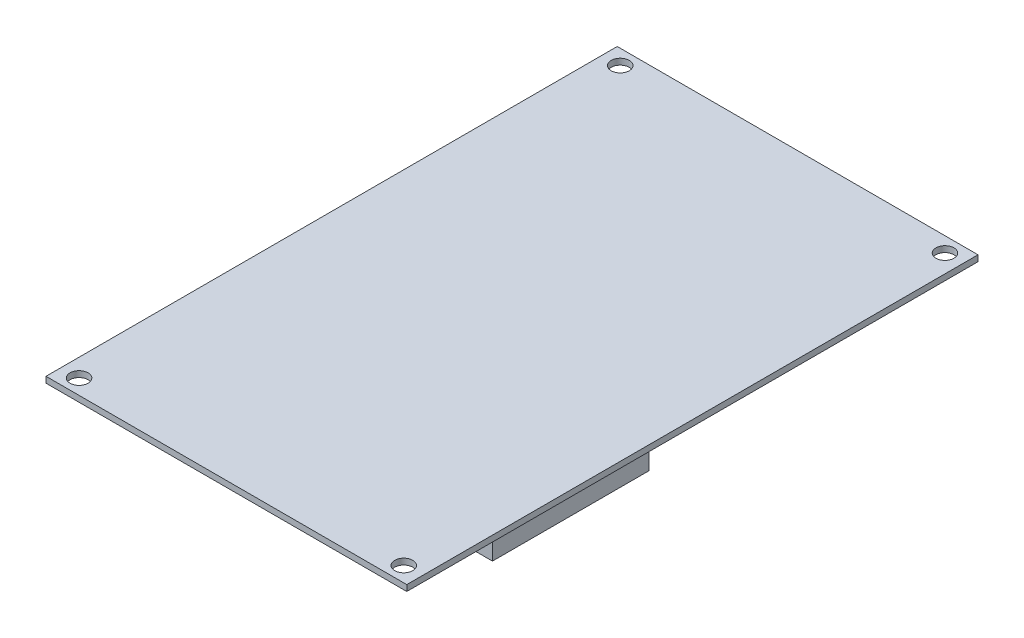
from build123d import *

# Parameters (mm, degrees)
SKETCH1_W           = 60
SKETCH1_H           = 95
BOSS_EXTRUDE1_DEPTH = 1
SKETCH2_W           = 5
SKETCH2_H           = 26
BOSS_EXTRUDE2_DEPTH = 8.5
CUT_EXTRUDE1_REACH  = 58.978
SKETCH3_R           = 1.5


with BuildPart() as part:
    # Sketch1 → Boss-Extrude1 (new body)
    with BuildSketch(Plane(origin=(0, 0, 0), x_dir=(1, 0, 0), z_dir=(0, 1, 0))):
        Rectangle(SKETCH1_W, SKETCH1_H)
    extrude(amount=BOSS_EXTRUDE1_DEPTH)

    # Sketch2 → Boss-Extrude2 (add)
    with BuildSketch(Plane.XZ):
        with Locations((21.75, 14.5)):
            Rectangle(SKETCH2_W, SKETCH2_H)
        with Locations((-21.75, 14.5)):
            Rectangle(SKETCH2_W, SKETCH2_H)
    extrude(amount=BOSS_EXTRUDE2_DEPTH)

    # Sketch3 → Cut-Extrude1 (cut, up to next)
    with BuildSketch(Plane(origin=(0, 1, 0), x_dir=(1, 0, 0), z_dir=(0, 1, 0)), mode=Mode.PRIVATE) as cut_extrude1_sk1:
        with Locations(Location((-27, -45, 0), (0, 0, 270))):
            Circle(SKETCH3_R)
    cut_extrude1_tool1 = extrude(cut_extrude1_sk1.sketch, amount=-CUT_EXTRUDE1_REACH, mode=Mode.PRIVATE) & part.part
    # Sketch3 → Cut-Extrude1 (cut, up to next)
    with BuildSketch(Plane(origin=(0, 1, 0), x_dir=(1, 0, 0), z_dir=(0, 1, 0)), mode=Mode.PRIVATE) as cut_extrude1_sk2:
        with Locations(Location((27, -45, 0), (0, 0, 270))):
            Circle(SKETCH3_R)
    cut_extrude1_tool2 = extrude(cut_extrude1_sk2.sketch, amount=-CUT_EXTRUDE1_REACH, mode=Mode.PRIVATE) & part.part
    # Sketch3 → Cut-Extrude1 (cut, up to next)
    with BuildSketch(Plane(origin=(0, 1, 0), x_dir=(1, 0, 0), z_dir=(0, 1, 0)), mode=Mode.PRIVATE) as cut_extrude1_sk3:
        with Locations(Location((27, 45, 0), (0, 0, 270))):
            Circle(SKETCH3_R)
    cut_extrude1_tool3 = extrude(cut_extrude1_sk3.sketch, amount=-CUT_EXTRUDE1_REACH, mode=Mode.PRIVATE) & part.part
    # Sketch3 → Cut-Extrude1 (cut, up to next)
    with BuildSketch(Plane(origin=(0, 1, 0), x_dir=(1, 0, 0), z_dir=(0, 1, 0)), mode=Mode.PRIVATE) as cut_extrude1_sk4:
        with Locations(Location((-27, 45, 0), (0, 0, 270))):
            Circle(SKETCH3_R)
    cut_extrude1_tool4 = extrude(cut_extrude1_sk4.sketch, amount=-CUT_EXTRUDE1_REACH, mode=Mode.PRIVATE) & part.part
    add(cut_extrude1_tool1.solids().sort_by_distance((-27, 1, 45))[0], mode=Mode.SUBTRACT)
    add(cut_extrude1_tool2.solids().sort_by_distance((27, 1, 45))[0], mode=Mode.SUBTRACT)
    add(cut_extrude1_tool3.solids().sort_by_distance((27, 1, -45))[0], mode=Mode.SUBTRACT)
    add(cut_extrude1_tool4.solids().sort_by_distance((-27, 1, -45))[0], mode=Mode.SUBTRACT)


solid = part.part
